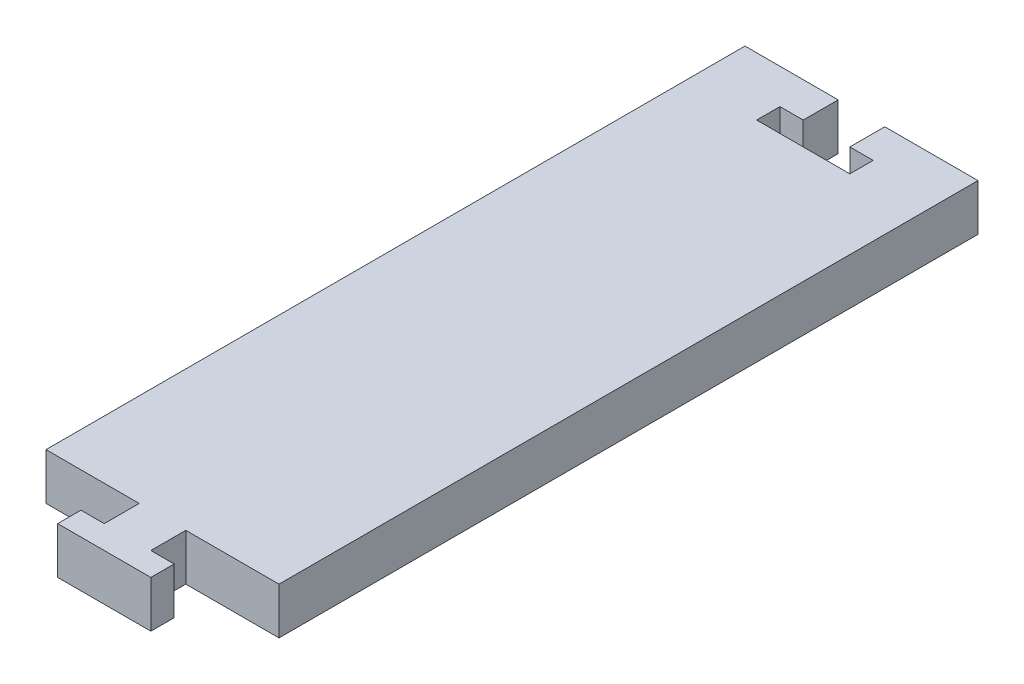
from build123d import *

# Parameters (mm, degrees)
EXTRUDE_1_DEPTH = 4


with BuildPart() as part:
    # Эскиз1 → Бобышка-Вытянуть1 (new body)
    with BuildSketch(Plane(origin=(0, 0, 0), x_dir=(1, 0, 0), z_dir=(0, 1, 0))):
        Polygon((10, -17.5), (2, -17.5), (2, -20.5), (4, -20.5), (4, -22.5), (-4, -22.5), (-4, -20.5), (-2, -20.5), (-2, -17.5), (-10, -17.5), (-10, 42.5), (-2, 42.5), (-2, 39.5), (-4, 39.5), (-4, 37.5), (4, 37.5), (4, 39.5), (2, 39.5), (2, 42.5), (10, 42.5), align=None)
    extrude(amount=EXTRUDE_1_DEPTH)


solid = part.part
